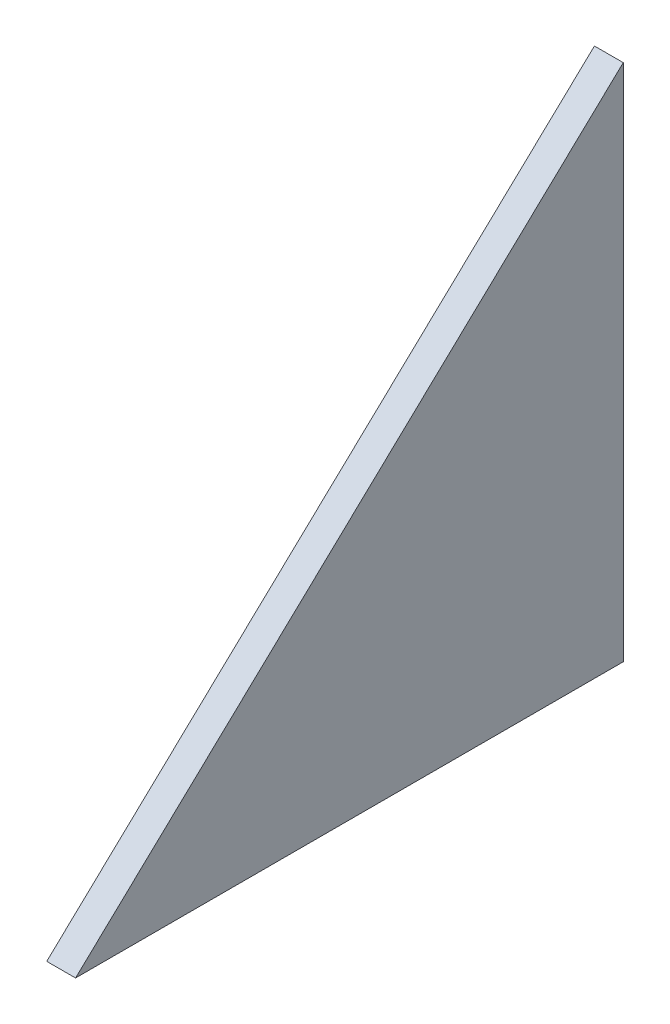
from build123d import *

# Parameters (mm, degrees)
BOSS_EXTRUDE1_DEPTH = 5


with BuildPart() as part:
    # Sketch1 → Boss-Extrude1 (new body)
    with BuildSketch(Plane(origin=(0, 0, 0), x_dir=(0, 0, -1), z_dir=(1, 0, 0))):
        Polygon((0, 0), (95, 0), (95, 90), align=None)
    extrude(amount=BOSS_EXTRUDE1_DEPTH)


solid = part.part
